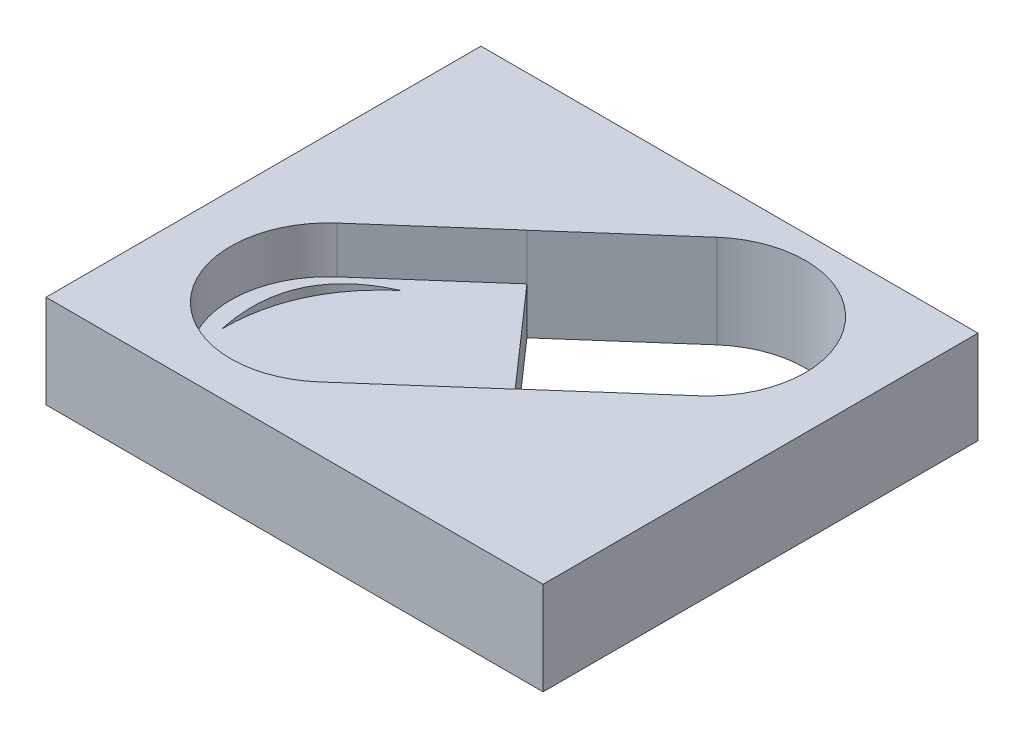
from build123d import *

# Parameters (mm, degrees)
SKETCH1_W           = 16
SKETCH1_H           = 14
BOSS_EXTRUDE1_DEPTH = 3
CUT_EXTRUDE2_DEPTH  = 3
CUT_EXTRUDE3_DEPTH  = 1.5


with BuildPart() as part:
    # Sketch1 → Boss-Extrude1 (new body)
    with BuildSketch(Plane(origin=(0, 0, 0), x_dir=(1, 0, 0), z_dir=(0, 1, 0))):
        with Locations((-34.802547771, 15.318471338)):
            Rectangle(SKETCH1_W, SKETCH1_H)
    extrude(amount=BOSS_EXTRUDE1_DEPTH)

    # Sketch2 → Cut-Extrude2 (cut)
    with BuildSketch(Plane(origin=(0, 3, 0), x_dir=(1, 0, 0), z_dir=(0, 1, 0))):
        with BuildLine():
            Line((-33.679958269, 20.786982613), (-36.931417033, 17.926726524))
            Line((-36.931417033, 17.926726524), (-32.794432226, 13.223918421))
            Line((-32.794432226, 13.223918421), (-29.542973461, 16.08417451))
            ThreePointArc((-29.542973461, 16.08417451), (-29.260061814, 20.504070965), (-33.679958269, 20.786982613))
        make_face()
        with BuildLine():
            add(Edge.make_bspline(
                [(-40.589081196, 11.760287037), (-40.601113462, 14.156732858), (-38.765129592, 15.72931278)],
                knots=[0, 0, 0, 1, 1, 1], degree=2))
            add(Edge.make_bspline(
                [(-38.765129592, 15.72931278), (-40.696042452, 14.851396093), (-40.927669041, 13.342903488), (-40.589081196, 11.760287037)],
                knots=[0, 0, 0, 0, 1, 1, 1, 1], degree=3))
        make_face()
    extrude(amount=-CUT_EXTRUDE2_DEPTH, mode=Mode.SUBTRACT)

    # Sketch3 → Cut-Extrude3 (cut)
    with BuildSketch(Plane(origin=(0, 3, 0), x_dir=(1, 0, 0), z_dir=(0, 1, 0))):
        with BuildLine():
            Line((-32.790440937, 13.219381237), (-36.041899701, 10.359125148))
            ThreePointArc((-36.041899701, 10.359125148), (-40.470324629, 10.642582691), (-40.186867086, 15.071007619))
            Line((-40.186867086, 15.071007619), (-36.935408322, 17.931263708))
            Line((-36.935408322, 17.931263708), (-32.790440937, 13.219381237))
        make_face()
    extrude(amount=-CUT_EXTRUDE3_DEPTH, mode=Mode.SUBTRACT)


solid = part.part
